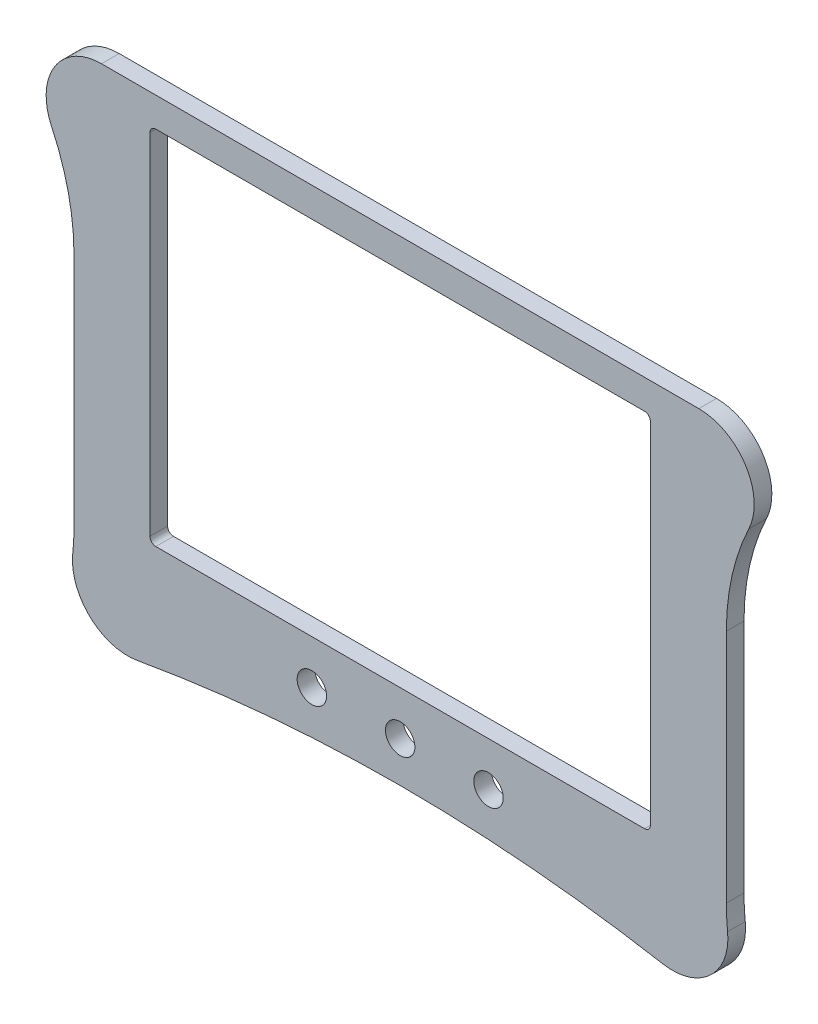
from build123d import *

# Parameters (mm, degrees)
BOSS_EXTRUDE1_DEPTH = 3.81
SKETCH2_R           = 3.175
CUT_EXTRUDE1_DEPTH  = 434.546807932


with BuildPart() as part:
    # Sketch1 → Boss-Extrude1 (new body)
    with BuildSketch(Plane.XY):
        with BuildLine():
            Line((70.358, 337.34375), (70.358, 388.14375))
            ThreePointArc((70.358, 388.14375), (71.586192113, 399.190379334), (75.210780547, 409.697464286))
            ThreePointArc((75.210780547, 409.697464286), (74.514154695, 421.194879412), (64.424703202, 426.75175))
            Line((64.424703202, 426.75175), (-64.424703202, 426.75175))
            ThreePointArc((-64.424703202, 426.75175), (-74.514154695, 421.194879412), (-75.210780547, 409.697464286))
            ThreePointArc((-75.210780547, 409.697464286), (-71.586192113, 399.190379334), (-70.358, 388.14375))
            Line((-70.358, 388.14375), (-70.358, 337.34375))
            ThreePointArc((-70.358, 337.34375), (-70.425674666, 334.735607232), (-70.628516531, 332.134483679))
            ThreePointArc((-70.628516531, 332.134483679), (-66.887034969, 322.158291888), (-56.667646584, 319.143795582))
            ThreePointArc((-56.667646584, 319.143795582), (0, 324.13575), (56.667646584, 319.143795582))
            ThreePointArc((56.667646584, 319.143795582), (66.887034969, 322.158291888), (70.628516531, 332.134483679))
            ThreePointArc((70.628516531, 332.134483679), (70.425674666, 334.735607232), (70.358, 337.34375))
        make_face()
    extrude(amount=BOSS_EXTRUDE1_DEPTH)

    # Sketch2 → Cut-Extrude1 (cut, through all)
    with BuildSketch(Plane.XY.offset(3.81)):
        with Locations((-19.05, 332.89875)):
            Circle(SKETCH2_R)
        with Locations((0, 332.89875)):
            Circle(SKETCH2_R)
        with Locations((19.05, 332.89875)):
            Circle(SKETCH2_R)
        with BuildLine():
            Line((-52.705, 420.40175), (52.705, 420.40175))
            ThreePointArc((52.705, 420.40175), (53.603025612, 420.029775612), (53.975, 419.13175))
            Line((53.975, 419.13175), (53.975, 343.69375))
            ThreePointArc((53.975, 343.69375), (53.603025612, 342.795724388), (52.705, 342.42375))
            Line((52.705, 342.42375), (-52.705, 342.42375))
            ThreePointArc((-52.705, 342.42375), (-53.603025612, 342.795724388), (-53.975, 343.69375))
            Line((-53.975, 343.69375), (-53.975, 419.13175))
            ThreePointArc((-53.975, 419.13175), (-53.603025612, 420.029775612), (-52.705, 420.40175))
        make_face()
    extrude(amount=-CUT_EXTRUDE1_DEPTH, mode=Mode.SUBTRACT)


solid = part.part
